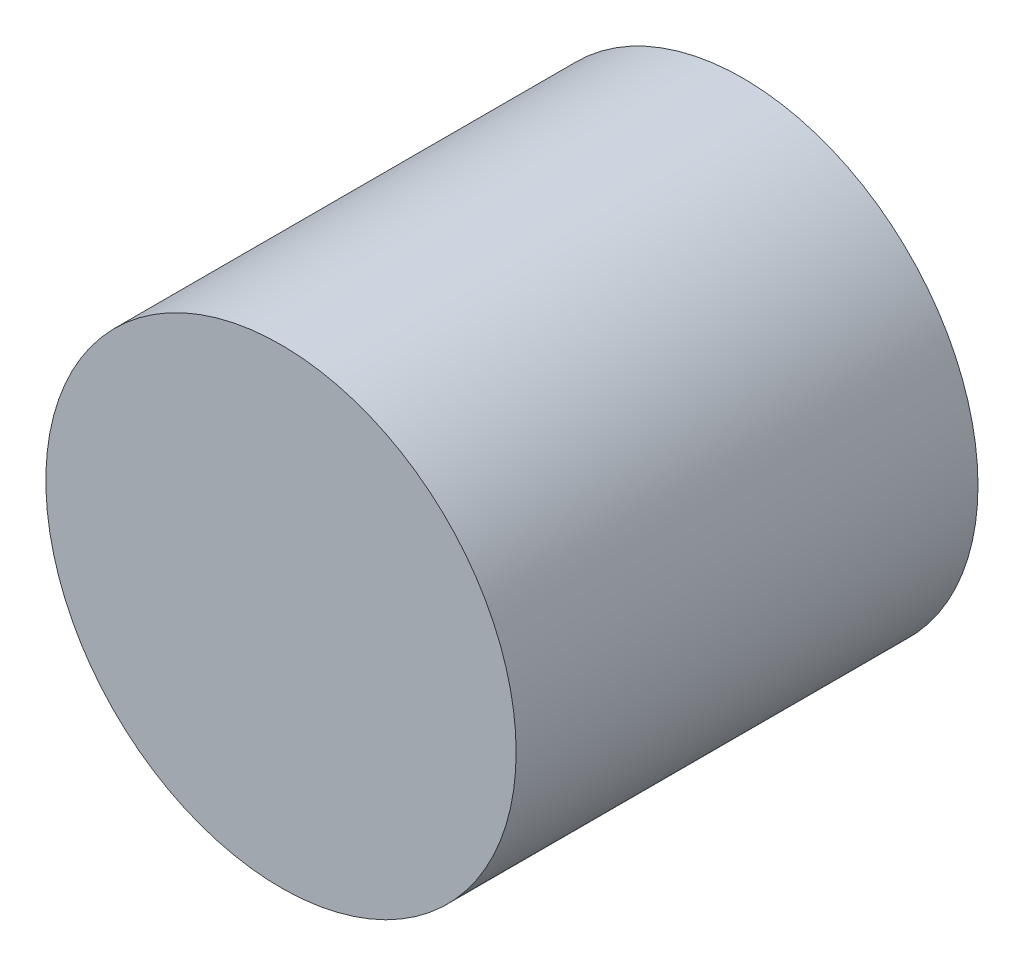
from build123d import *

# Parameters (mm, degrees)
ESQUISSE1_R          = 5.0915
BASE_EXTRUSION_DEPTH = 10


with BuildPart() as part:
    # Esquisse1 → Base-Extrusion (new body)
    with BuildSketch(Plane.XY):
        Circle(ESQUISSE1_R)
    extrude(amount=-BASE_EXTRUSION_DEPTH)


solid = part.part
